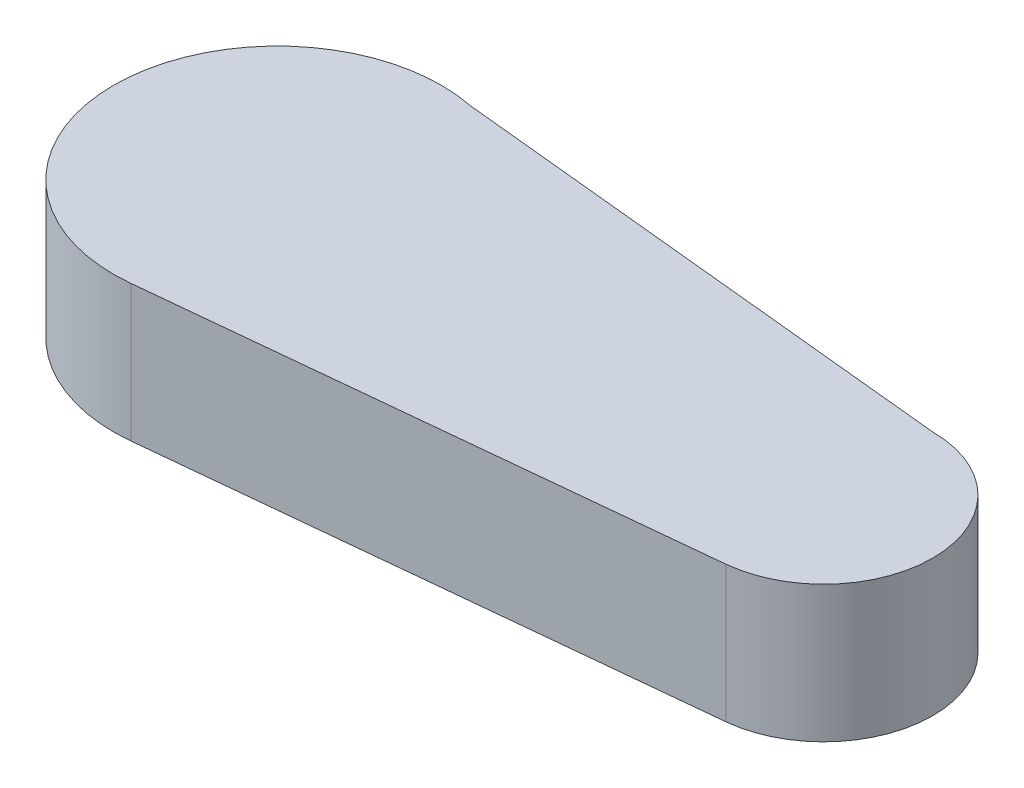
from build123d import *

# Parameters (mm, degrees)
BOSS_EXTRUDE1_DEPTH = 25


with BuildPart() as part:
    # Sketch3 → Boss-Extrude1 (new body)
    with BuildSketch(Plane(origin=(0, 0, 0), x_dir=(1, 0, 0), z_dir=(0, 1, 0))):
        with BuildLine():
            Line((-41.36818781, 29.405940594), (52.69121813, 20))
            ThreePointArc((52.69121813, 20), (72.666139593, 1.001255501), (54.69121813, -19.899748742))
            Line((54.69121813, -19.899748742), (-44.30878187, -29.849623113))
            ThreePointArc((-44.30878187, -29.849623113), (-77.271909428, 1.486938768), (-41.36818781, 29.405940594))
        make_face()
    extrude(amount=BOSS_EXTRUDE1_DEPTH)


solid = part.part
